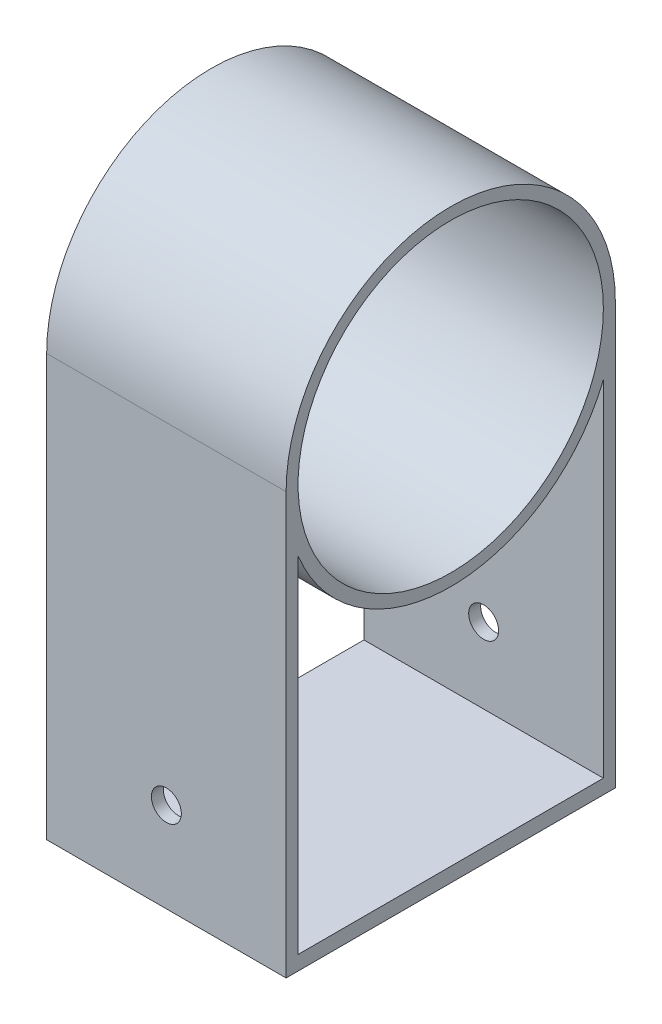
from build123d import *

# Parameters (mm, degrees)
SKETCH1_R           = 25.5
BOSS_EXTRUDE1_DEPTH = 40
SKETCH2_R           = 2.5
CUT_EXTRUDE1_DEPTH  = 98.850406679


with BuildPart() as part:
    # Sketch1 → Boss-Extrude1 (new body)
    with BuildSketch(Plane(origin=(0, 0, 0), x_dir=(0, 0, -1), z_dir=(1, 0, 0))):
        with BuildLine():
            Line((-27.5, 0), (-27.5, -70.354119191))
            Line((-27.5, -70.354119191), (27.5, -70.354119191))
            Line((27.5, -70.354119191), (27.5, 0))
            ThreePointArc((27.5, 0), (0, 27.5), (-27.5, 0))
        make_face()
        Circle(SKETCH1_R, mode=Mode.SUBTRACT)
        with BuildLine():
            Line((-25.5, -10.295630141), (-25.5, -67.945646506))
            Line((-25.5, -67.945646506), (25.5, -67.945646506))
            Line((25.5, -67.945646506), (25.5, -10.295630141))
            ThreePointArc((25.5, -10.295630141), (0, -27.5), (-25.5, -10.295630141))
        make_face(mode=Mode.SUBTRACT)
    extrude(amount=-BOSS_EXTRUDE1_DEPTH)

    # Sketch2 → Cut-Extrude1 (cut, through all)
    with BuildSketch(Plane.XY.offset(27.5)):
        with Locations((-20, -55.354119191)):
            Circle(SKETCH2_R)
    extrude(amount=-CUT_EXTRUDE1_DEPTH, mode=Mode.SUBTRACT)


solid = part.part
